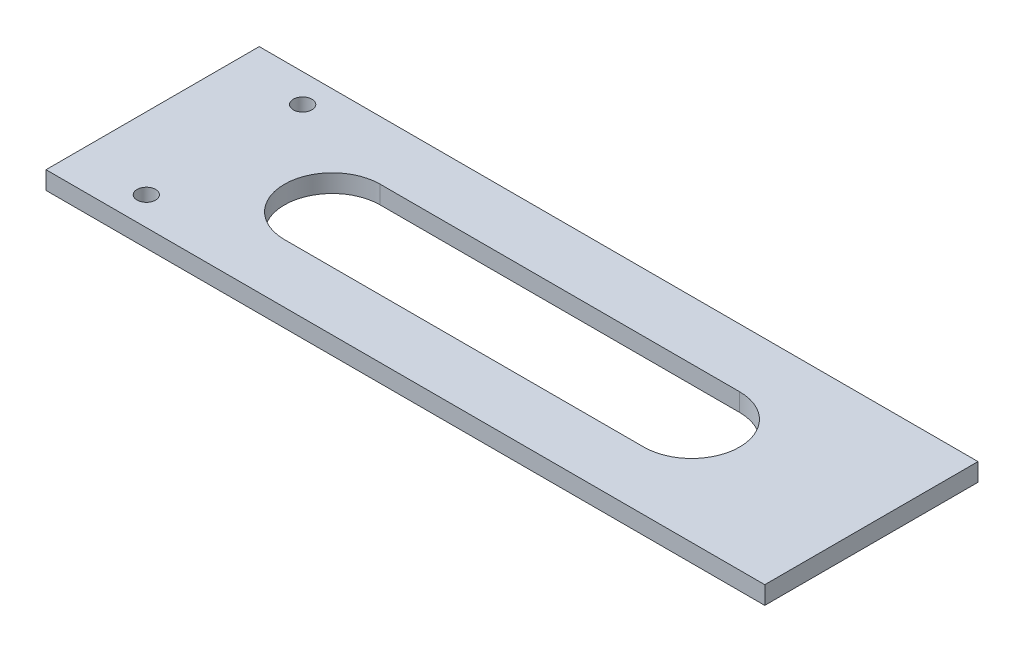
from build123d import *

# Parameters (mm, degrees)
SKETCH_1_W          = 120
SKETCH_1_H          = 35.6
EXTRUDE_1_DEPTH     = 3
SKETCH_2_R          = 1.55
CUT_EXTRUDE_1_DEPTH = 3


with BuildPart() as part:
    # 草图1 → 凸台-拉伸1 (new body)
    with BuildSketch(Plane(origin=(0, 0, 0), x_dir=(1, 0, 0), z_dir=(0, 1, 0))):
        with Locations((60, 17.8)):
            Rectangle(SKETCH_1_W, SKETCH_1_H)
        with BuildLine():
            Line((30, 25.8), (90, 25.8))
            ThreePointArc((90, 25.8), (98, 17.8), (90, 9.8))
            Line((90, 9.8), (30, 9.8))
            ThreePointArc((30, 9.8), (22, 17.8), (30, 25.8))
        make_face(mode=Mode.SUBTRACT)
    extrude(amount=EXTRUDE_1_DEPTH)

    # 草图2 → 切除-拉伸1 (cut)
    with BuildSketch(Plane.XZ):
        with Locations((138, -4.75)):
            Circle(SKETCH_2_R)
        with Locations((138, -30.85)):
            Circle(SKETCH_2_R)
        with Locations(Location((12, -30.85, 0), (0, 0, 270))):
            Circle(SKETCH_2_R)
        with Locations(Location((12, -4.75, 0), (0, 0, 270))):
            Circle(SKETCH_2_R)
    extrude(amount=-CUT_EXTRUDE_1_DEPTH, mode=Mode.SUBTRACT)


solid = part.part
